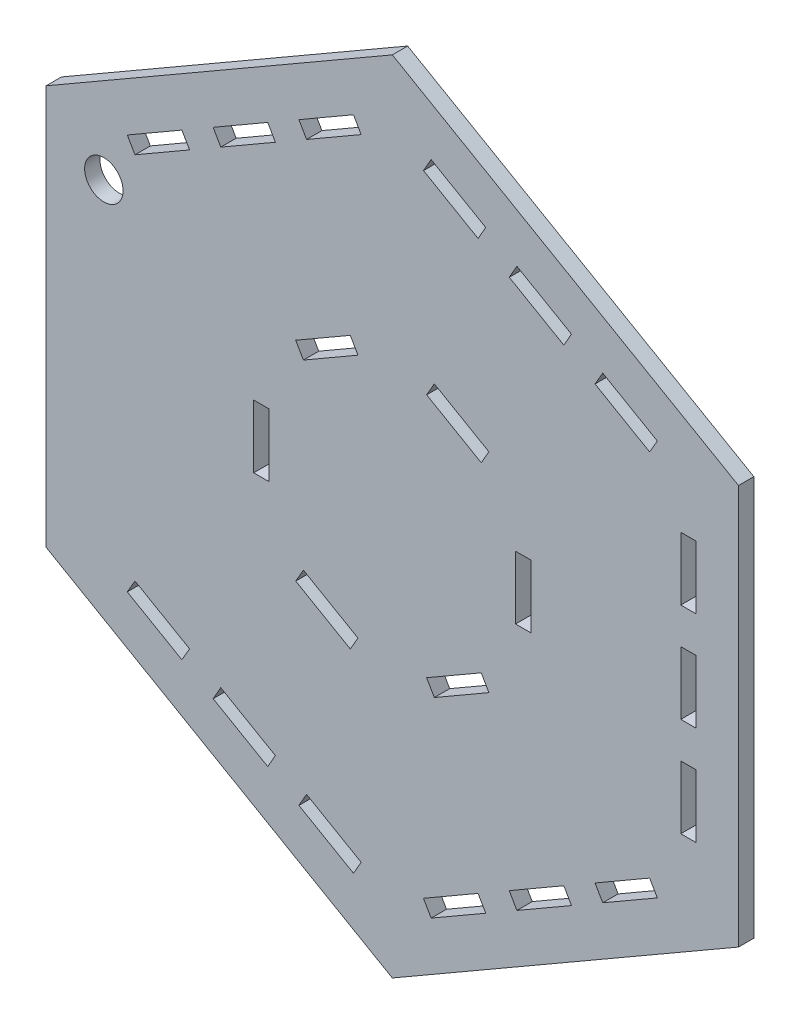
from build123d import *

# Parameters (mm, degrees)
CROQUIS1_R              = 3.75
CROQUIS1_W              = 3
CROQUIS1_H              = 12.3
SALIENTE_EXTRUIR1_DEPTH = 3


with BuildPart() as part:
    # Croquis1 → Saliente-Extruir1 (new body)
    with BuildSketch(Plane.XY):
        Polygon((-34.033695548, 97.071783877), (-101.583677043, 58.071783877), (-101.583677043, -19.928216123), (-34.033695548, -58.928216123), (33.516285947, -19.928216123), (33.516285947, 58.071783877), align=None)
        with Locations((-90.325346794, 47.821783877)):
            Circle(CROQUIS1_R, mode=Mode.SUBTRACT)
        Polygon((-51.384514513, 1.319283877), (-52.884514513, -1.278792335), (-42.232402047, -7.428792335), (-40.732402047, -4.830716123), align=None, mode=Mode.SUBTRACT)
        Polygon((-26.461178531, 83.163890705), (-27.949867087, 80.559283877), (-17.297738084, 74.409274329), (-15.809049529, 77.013881158), align=None, mode=Mode.SUBTRACT)
        Polygon((7.033309637, 63.825838945), (17.685438639, 57.675829398), (16.174127236, 55.084283877), (5.521998234, 61.234293424), align=None, mode=Mode.SUBTRACT)
        Polygon((5.521998234, -23.090725671), (7.033309637, -25.682271192), (17.685438639, -19.532261645), (16.174127236, -16.940716123), align=None, mode=Mode.SUBTRACT)
        Polygon((-9.725254139, 73.501400252), (-11.213942694, 70.896793424), (-0.561813692, 64.746783877), (0.926874864, 67.351390705), align=None, mode=Mode.SUBTRACT)
        Polygon((0.926874864, -29.207822952), (-9.725254139, -35.357832499), (-11.213942694, -32.753225671), (-0.561813692, -26.603216123), align=None, mode=Mode.SUBTRACT)
        Polygon((-15.809049529, -38.870313405), (-26.461178531, -45.020322952), (-27.949867087, -42.415716123), (-17.297738084, -36.265706576), align=None, mode=Mode.SUBTRACT)
        Polygon((-50.769653012, -36.265706576), (-52.258341568, -38.870313405), (-41.606212565, -45.020322952), (-40.11752401, -42.415716123), align=None, mode=Mode.SUBTRACT)
        Polygon((-67.505577405, -26.603216123), (-68.99426596, -29.207822952), (-58.342136958, -35.357832499), (-56.853448402, -32.753225671), align=None, mode=Mode.SUBTRACT)
        Polygon((-84.241518333, -16.940716123), (-73.58938933, -23.090725671), (-75.100700733, -25.682271192), (-85.752829736, -19.532261645), align=None, mode=Mode.SUBTRACT)
        Polygon((-73.58938933, 61.234293424), (-75.100700733, 63.825838945), (-85.752829736, 57.675829398), (-84.241518333, 55.084283877), align=None, mode=Mode.SUBTRACT)
        Polygon((-68.99426596, 67.351390705), (-58.342136958, 73.501400252), (-56.853448402, 70.896793424), (-67.505577405, 64.746783877), align=None, mode=Mode.SUBTRACT)
        Polygon((-52.258341568, 77.013881158), (-41.606212565, 83.163890705), (-40.11752401, 80.559283877), (-50.769653012, 74.409274329), align=None, mode=Mode.SUBTRACT)
        with Locations((23.757955698, 38.396783877)):
            Rectangle(CROQUIS1_W, CROQUIS1_H, mode=Mode.SUBTRACT)
        with Locations((23.757955698, 19.071783877)):
            Rectangle(CROQUIS1_W, CROQUIS1_H, mode=Mode.SUBTRACT)
        with Locations((23.757955698, -0.253216123)):
            Rectangle(CROQUIS1_W, CROQUIS1_H, mode=Mode.SUBTRACT)
        Polygon((-25.83498905, 45.572360088), (-15.182876583, 39.422360088), (-16.682876583, 36.824283877), (-27.33498905, 42.974283877), align=None, mode=Mode.SUBTRACT)
        Polygon((-52.884514513, 39.422360088), (-42.232402047, 45.572360088), (-40.732402047, 42.974283877), (-51.384514513, 36.824283877), align=None, mode=Mode.SUBTRACT)
        Polygon((-27.33498905, -4.830716123), (-25.83498905, -7.428792335), (-15.182876583, -1.278792335), (-16.682876583, 1.319283877), align=None, mode=Mode.SUBTRACT)
        with Locations((-8.484170085, 19.071783877)):
            Rectangle(CROQUIS1_W, CROQUIS1_H, mode=Mode.SUBTRACT)
        with Locations((-59.583221011, 19.071783877)):
            Rectangle(CROQUIS1_W, CROQUIS1_H, mode=Mode.SUBTRACT)
    extrude(amount=SALIENTE_EXTRUIR1_DEPTH)


solid = part.part
